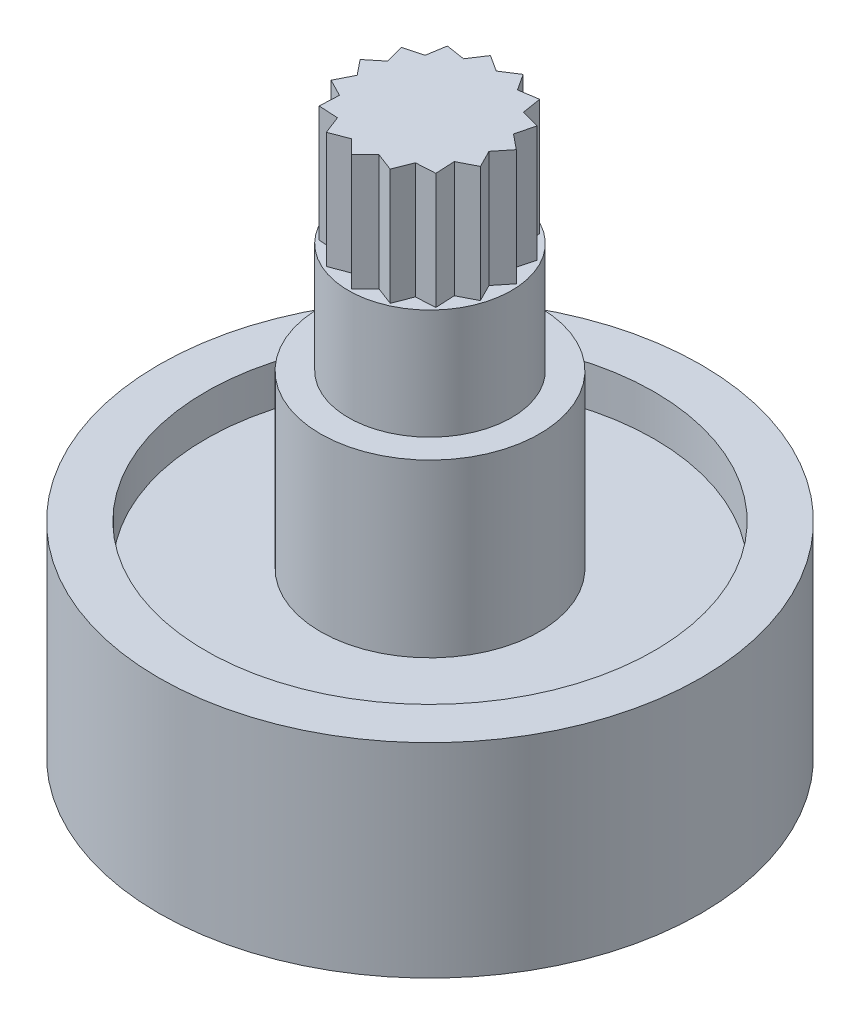
from build123d import *

# Parameters (mm, degrees)
CUT_EXTRUDE1_DEPTH = 5.7
CIRPATTERN1_COUNT  = 15


with BuildPart() as part:
    # Sketch1 → 52 Tooth (revolve)
    with BuildSketch(Plane.XY, mode=Mode.PRIVATE) as f_52_tooth_sk:
        Polygon((13.3, 0), (13.3, 10), (11, 10), (11, 8), (5.375, 8), (5.375, 16.4), (4, 16.4), (4, 21.8), (3.85, 21.8), (3.85, 27.5), (0, 27.5), (0, 14.75), (3.55, 14.75), (3.55, 3.5), (7, 3.5), (7, 0), align=None)
    revolve(f_52_tooth_sk.sketch.rotate(Axis((0, 0, 0), (0, 1, 0)), 90), axis=Axis((0, 0, 0), (0, 1, 0)))

    # Sketch2 → Cut-Extrude1 (cut)
    with BuildSketch(Plane(origin=(0, 27.5, 0), x_dir=(1, 0, 0), z_dir=(0, 1, 0))):
        with BuildLine():
            ThreePointArc((0.80046001, 3.765868263), (0, 3.85), (-0.80046001, 3.765868263))
            Line((-0.80046001, 3.765868263), (0, 3.25))
            Line((0, 3.25), (0.80046001, 3.765868263))
        make_face()
    cut_extrude1 = extrude(amount=-CUT_EXTRUDE1_DEPTH, mode=Mode.SUBTRACT)

    # CirPattern1: Cut-Extrude1 ×15 about axis
    cirpattern1_axis = Axis((0, 0, 0), (0, 1, 0))
    for i in range(1, CIRPATTERN1_COUNT):
        add(cut_extrude1.rotate(cirpattern1_axis, i * 360 / CIRPATTERN1_COUNT), mode=Mode.SUBTRACT)


solid = part.part
